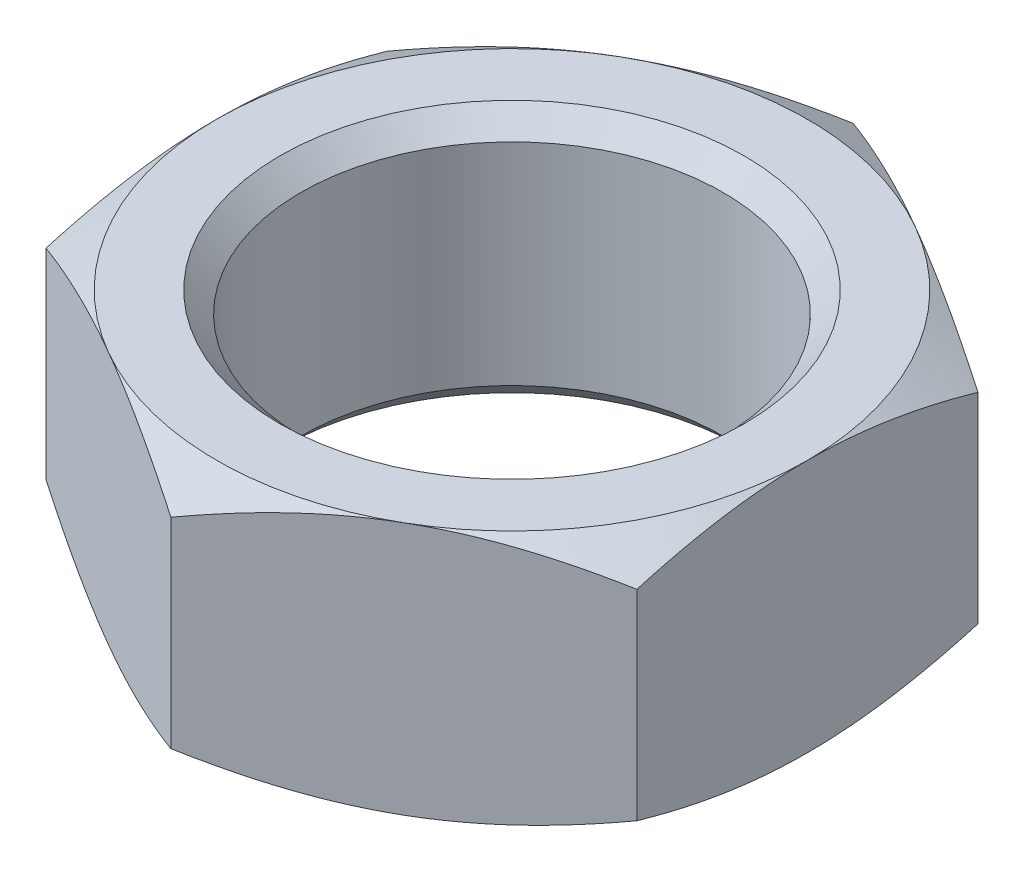
from build123d import *

# Parameters (mm, degrees)
BOSS_EXTRUDE1_DEPTH     = 6
SKETCH2_OUTSIDE_W       = 80.454
SKETCH2_OUTSIDE_H       = 84.786
SKETCH2_OUTSIDE_R       = 14
CUT_EXTRUDE1_DEPTH      = 12
CUT_EXTRUDE1_DRAFT      = -60
MIRROR1_COPY_1_SKETCH_W = 80.454
MIRROR1_COPY_1_SKETCH_H = 84.786
MIRROR1_COPY_1_SKETCH_R = 14
MIRROR1_COPY_1_DEPTH    = 12
MIRROR1_COPY_1_DRAFT    = -60
SKETCH3_R               = 10
CUT_EXTRUDE2_DEPTH      = 25.522098877
CHAMFER1_SIZE           = 1


with BuildPart() as part:
    # Sketch1 → Boss-Extrude1 (new, symmetric)
    with BuildSketch(Plane(origin=(0, 0, 0), x_dir=(1, 0, 0), z_dir=(0, 1, 0))):
        Polygon((14, 8.082903769), (0, 16.165807537), (-14, 8.082903769), (-14, -8.082903769), (0, -16.165807537), (14, -8.082903769), align=None)
    extrude(amount=BOSS_EXTRUDE1_DEPTH, both=True)


with BuildPart() as cut_extrude1_tool:
    # Sketch2 outside → Cut-Extrude1 (with draft: the straight prism first)
    with BuildSketch(Plane(origin=(0, 6, 0), x_dir=(1, 0, 0), z_dir=(0, 1, 0))):
        Rectangle(SKETCH2_OUTSIDE_W, SKETCH2_OUTSIDE_H)
        Circle(SKETCH2_OUTSIDE_R, mode=Mode.SUBTRACT)
    extrude(amount=-CUT_EXTRUDE1_DEPTH)
    # Cut-Extrude1: the draft: its side faces are tilted about the plane it starts from
    cut_extrude1_sides = [cut_extrude1_tool.faces().sort_by_distance(p)[0] for p in [
        (0, 0, 42.393),
        (40.227, 0, 0),
        (0, 0, -42.393),
        (-40.227, 0, 0),
        (-14, 0, 0),
    ]]
    draft(cut_extrude1_sides, Plane(origin=(0, 6, 0), x_dir=(1, 0, 0), z_dir=(0, 1, 0)), CUT_EXTRUDE1_DRAFT)


with BuildPart() as part_1:
    add(part.part)

    # Cut-Extrude1: cut by cut_extrude1_tool
    add(cut_extrude1_tool.part, mode=Mode.SUBTRACT)


with BuildPart() as mirror1_copy_1_tool:
    # Mirror1 copy 1 sketch → Mirror1 copy 1 (with draft: the straight prism first)
    with BuildSketch(Plane.XZ.offset(6)):
        Rectangle(MIRROR1_COPY_1_SKETCH_W, MIRROR1_COPY_1_SKETCH_H)
        Circle(MIRROR1_COPY_1_SKETCH_R, mode=Mode.SUBTRACT)
    extrude(amount=-MIRROR1_COPY_1_DEPTH)
    # Mirror1 copy 1: the draft: its side faces are tilted about the plane it starts from
    mirror1_copy_1_sides = [mirror1_copy_1_tool.faces().sort_by_distance(p)[0] for p in [
        (0, 0, 42.393),
        (40.227, 0, 0),
        (0, 0, -42.393),
        (-40.227, 0, 0),
        (-14, 0, 0),
    ]]
    draft(mirror1_copy_1_sides, Plane.XZ.offset(6), MIRROR1_COPY_1_DRAFT)


with BuildPart() as part_2:
    add(part_1.part)

    # Mirror1 copy 1: cut by mirror1_copy_1_tool
    add(mirror1_copy_1_tool.part, mode=Mode.SUBTRACT)

    # Sketch3 → Cut-Extrude2 (cut, through all)
    with BuildSketch(Plane(origin=(0, 6, 0), x_dir=(1, 0, 0), z_dir=(0, 1, 0))):
        with Locations(Location((0, 0, 0), (0, 0, 270))):
            Circle(SKETCH3_R)
    extrude(amount=-CUT_EXTRUDE2_DEPTH, mode=Mode.SUBTRACT)

    # Chamfer1
    chamfer1_edges = [part_2.edges().sort_by_distance(p)[0] for p in [
        (0, -6, -10),
        (0, 6, -10),
    ]]
    chamfer(chamfer1_edges, length=CHAMFER1_SIZE)


solid = part_2.part
